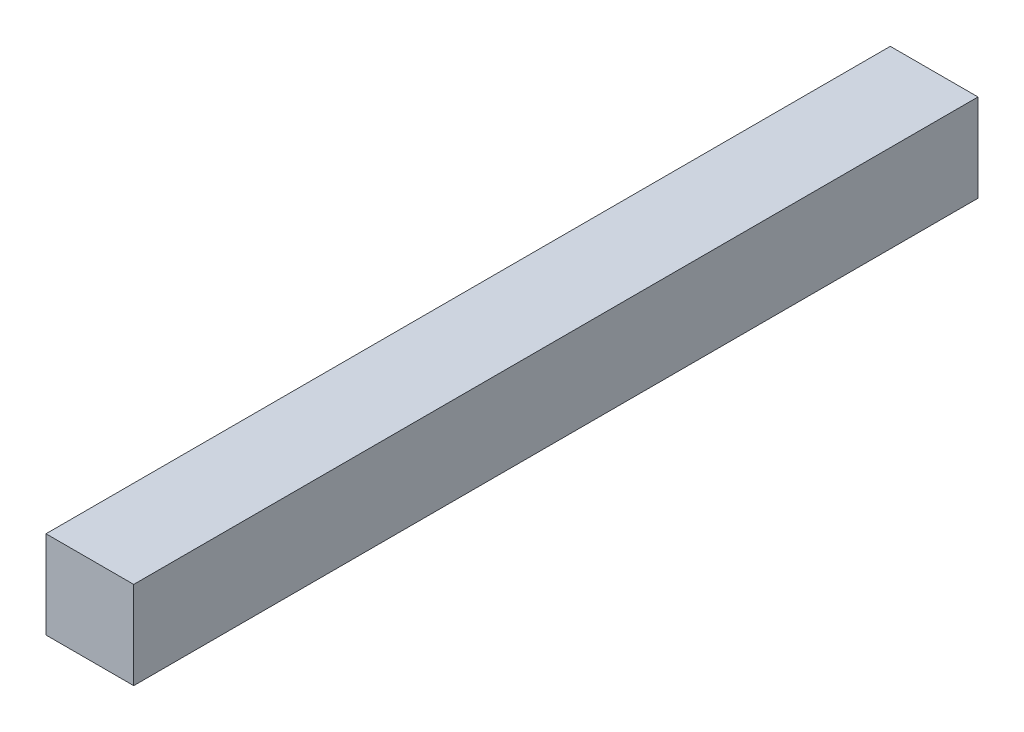
from build123d import *

# Parameters (mm, degrees)
SKETCH1_W           = 8
SKETCH1_H           = 8
BOSS_EXTRUDE1_DEPTH = 38.5


with BuildPart() as part:
    # Sketch1 → Boss-Extrude1 (new, symmetric)
    with BuildSketch(Plane.XY):
        Rectangle(SKETCH1_W, SKETCH1_H)
    extrude(amount=BOSS_EXTRUDE1_DEPTH, both=True)


solid = part.part
